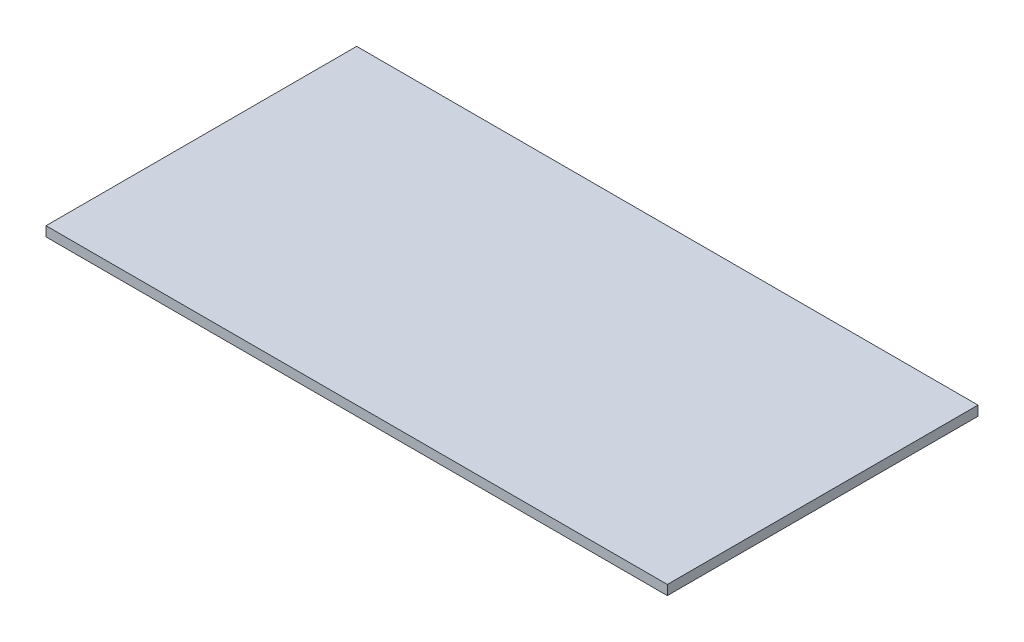
from build123d import *

# Parameters (mm, degrees)
SKETCH1_W           = 304.8
SKETCH1_H           = 152.4
BOSS_EXTRUDE2_DEPTH = 4.7625


with BuildPart() as part:
    # Sketch1 → Boss-Extrude2 (new body)
    with BuildSketch(Plane(origin=(0, 0, 0), x_dir=(1, 0, 0), z_dir=(0, 1, 0))):
        with Locations((93.271051813, 47.799481579)):
            Rectangle(SKETCH1_W, SKETCH1_H)
    extrude(amount=BOSS_EXTRUDE2_DEPTH)


solid = part.part
